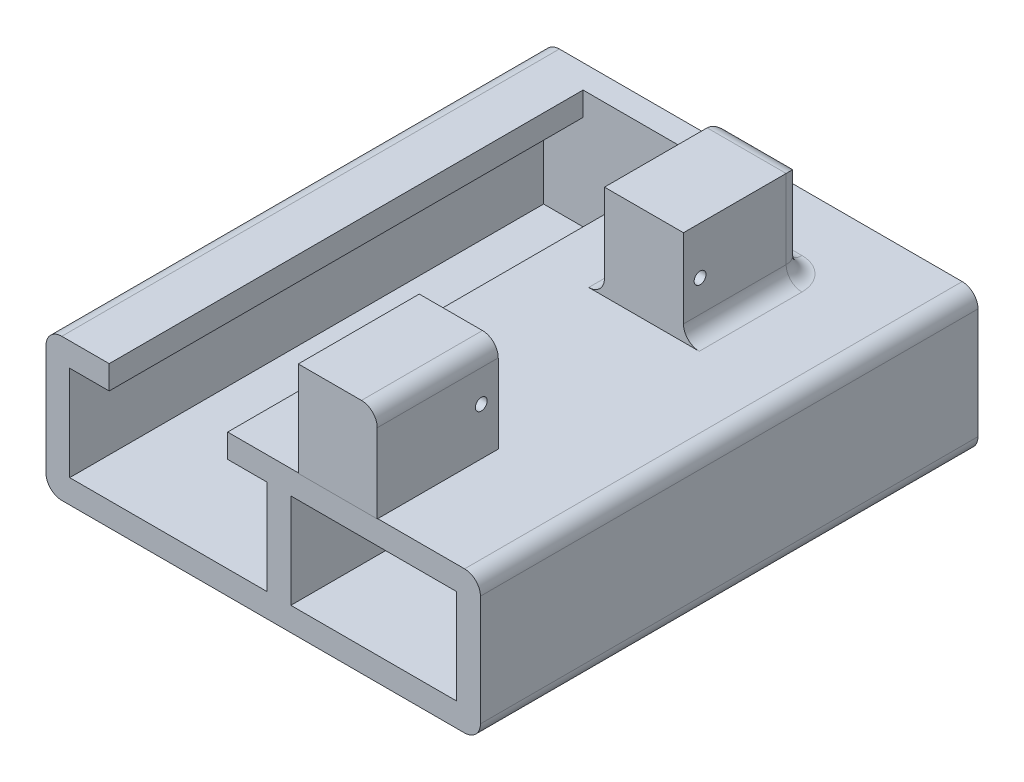
from build123d import *

# Parameters (mm, degrees)
SKETCH1_W           = 21
SKETCH1_H           = 12
BOSS_EXTRUDE1_DEPTH = 60
SKETCH2_W           = 15
SKETCH2_H           = 12
SKETCH2_R           = 0.75
SKETCH2_W_2         = 15.320483989
BOSS_EXTRUDE2_DEPTH = 10
SKETCH3_W           = 55
SKETCH3_H           = 18
BOSS_EXTRUDE3_DEPTH = 3
FILLET1_R           = 2


with BuildPart() as part:
    # Sketch1 → Boss-Extrude1 (new body)
    with BuildSketch(Plane.XY):
        Polygon((17.509291985, 21.588576814), (-9.490708015, 21.588576814), (-14.490708015, 21.588576814), (-14.490708015, 18.588576814), (-9.490708015, 18.588576814), (-9.490708015, 6.588576814), (-34.490708015, 6.588576814), (-34.490708015, 18.588576814), (-29.490708015, 18.588576814), (-29.490708015, 21.588576814), (-34.490708015, 21.588576814), (-37.490708015, 21.588576814), (-37.490708015, 3.588576814), (17.509291985, 3.588576814), align=None)
        with Locations((4.009291985, 12.588576814)):
            Rectangle(SKETCH1_W, SKETCH1_H, mode=Mode.SUBTRACT)
    extrude(amount=-BOSS_EXTRUDE1_DEPTH)

    # Sketch2 → Boss-Extrude2 (add)
    # profile 1 of 2: a face of its own
    with BuildSketch(Plane.ZY.offset(5.490708015)):
        with Locations((-46.209795844, 27.588576814)):
            Rectangle(SKETCH2_W, SKETCH2_H)
        with Locations(Location((-40.809795844, 27.588576814, 0), (0, 0, 270))):
            Circle(SKETCH2_R, mode=Mode.SUBTRACT)
    # profile 2 of 2: a face of its own
    with BuildSketch(Plane.ZY.offset(5.490708015)):
        with Locations((-7.59955385, 27.588576814)):
            Rectangle(SKETCH2_W_2, SKETCH2_H)
        with Locations(Location((-13.109795844, 27.588576814, 0), (0, 0, 270))):
            Circle(SKETCH2_R, mode=Mode.SUBTRACT)
    extrude(amount=-BOSS_EXTRUDE2_DEPTH)

    # Sketch3 → Boss-Extrude3 (add)
    with BuildSketch(Plane(origin=(0, 0, -60), x_dir=(-1, 0, 0), z_dir=(0, 0, -1))):
        with Locations((9.990708015, 12.588576814)):
            Rectangle(SKETCH3_W, SKETCH3_H)
    extrude(amount=BOSS_EXTRUDE3_DEPTH)

    # Fillet1
    fillet1_edges = [part.edges().sort_by_distance(p)[0] for p in [
        (17.509291985, 21.588576814, -31.5),
        (17.509291985, 3.588576814, -31.5),
        (-37.490708015, 3.588576814, -31.5),
        (-37.490708015, 21.588576814, -31.5),
        (-5.490708015, 21.588576814, -46.209795844),
        (4.509291985, 33.588576814, -7.59955385),
        (4.509291985, 27.588576814, -53.709795844),
        (-5.490708015, 27.588576814, -53.709795844),
        (-0.490708015, 33.588576814, -53.709795844),
        (4.509291985, 21.588576814, -46.209795844),
        (-0.490708015, 21.588576814, -53.709795844),
    ]]
    fillet(fillet1_edges, radius=FILLET1_R)


solid = part.part
